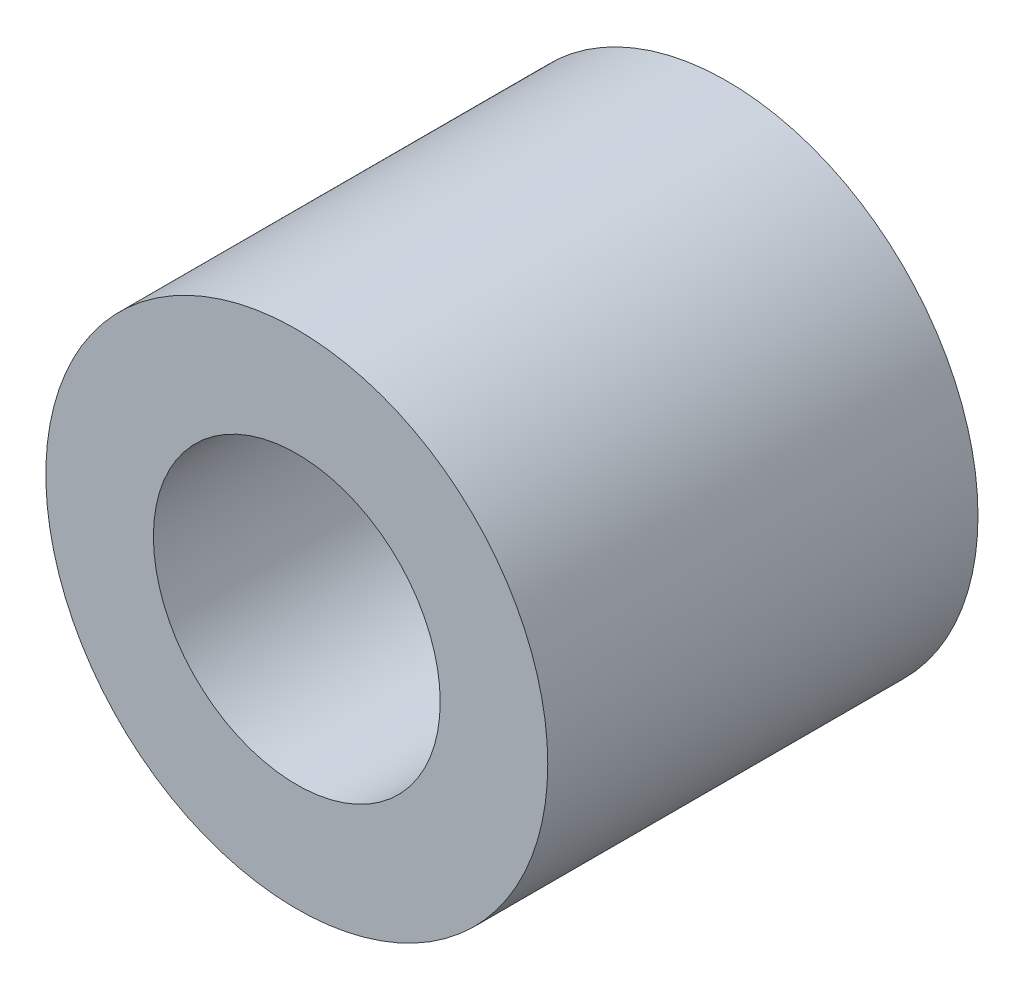
from build123d import *

# Parameters (mm, degrees)
SKETCH1_R           = 1.75
SKETCH1_R_2         = 1
BOSS_EXTRUDE1_DEPTH = 3


with BuildPart() as part:
    # Sketch1 → Boss-Extrude1 (new body)
    with BuildSketch(Plane.XY):
        Circle(SKETCH1_R)
        Circle(SKETCH1_R_2, mode=Mode.SUBTRACT)
    extrude(amount=BOSS_EXTRUDE1_DEPTH)


solid = part.part
